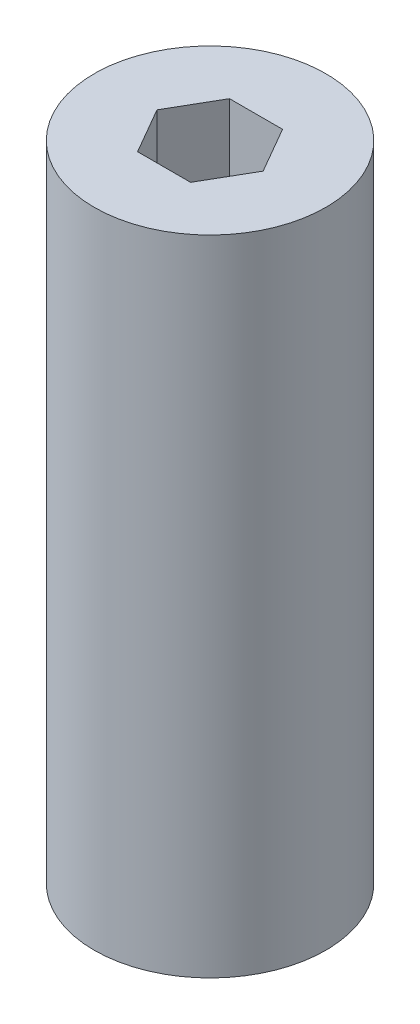
from build123d import *

# Parameters (mm, degrees)
SKETCH2_R           = 16.002
BOSS_EXTRUDE1_DEPTH = 88.9
CUT_EXTRUDE1_DEPTH  = 92.735151431


with BuildPart() as part:
    # Sketch2 → Boss-Extrude1 (new body)
    with BuildSketch(Plane(origin=(0, 0, 0), x_dir=(1, 0, 0), z_dir=(0, 1, 0))):
        with Locations(Location((0, 0, 0), (0, 0, 270))):
            Circle(SKETCH2_R)
    extrude(amount=BOSS_EXTRUDE1_DEPTH)

    # Sketch3 → Cut-Extrude1 (cut, through all)
    with BuildSketch(Plane(origin=(0, 88.9, 0), x_dir=(1, 0, 0), z_dir=(0, 1, 0))):
        Polygon((7.332348419, 0), (3.666174209, 6.35), (-3.666174209, 6.35), (-7.332348419, 0), (-3.666174209, -6.35), (3.666174209, -6.35), align=None)
    extrude(amount=-CUT_EXTRUDE1_DEPTH, mode=Mode.SUBTRACT)


solid = part.part
